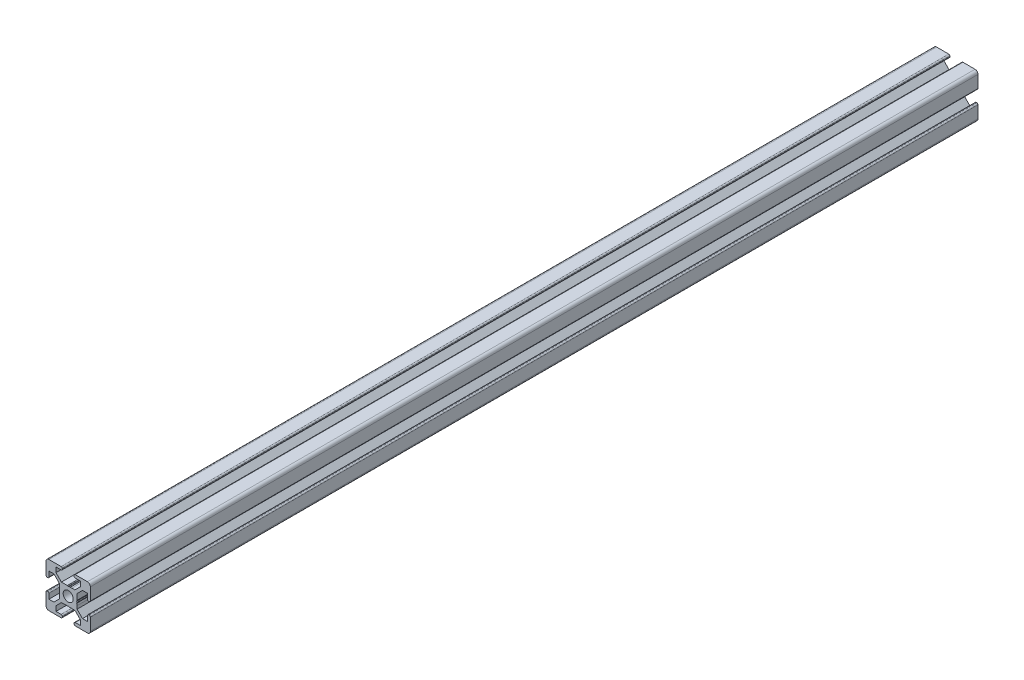
from build123d import *

# Parameters (mm, degrees)
SKETCH_11_R            = 3.4
F_30_X_30_X_R2_1_DEPTH = 600


with BuildPart() as part:
    # 草图11 → 铝型材 30 X 30 X R2(1) (new body)
    with BuildSketch(Plane.YX):
        with BuildLine():
            Line((-15, -4.8), (-15, -13))
            ThreePointArc((-15, -13), (-14.414213562, -14.414213562), (-13, -15))
            Line((-13, -15), (-4.8, -15))
            ThreePointArc((-4.8, -15), (-4.234314575, -14.765685425), (-4, -14.2))
            Line((-4, -14.2), (-4, -13.8))
            ThreePointArc((-4, -13.8), (-4.234314575, -13.234314575), (-4.8, -13))
            Line((-4.8, -13), (-8.25, -13))
            Line((-8.25, -13), (-8.25, -9.664213562))
            Line((-8.25, -9.664213562), (-4.585786438, -6))
            Line((-4.585786438, -6), (-0.653589838, -6))
            ThreePointArc((-0.653589838, -6), (-0.524180316, -5.982962913), (-0.403589838, -5.933012702))
            Line((-0.403589838, -5.933012702), (0, -5.7))
            Line((0, -5.7), (0.403589838, -5.933012702))
            ThreePointArc((0.403589838, -5.933012702), (0.653589838, -6), (0.903589838, -5.933012702))
            Line((0.903589838, -5.933012702), (1.218885629, -5.750976592))
            Line((1.218885629, -5.750976592), (2.5, -6))
            Line((2.5, -6), (4.585786438, -6))
            Line((4.585786438, -6), (8.25, -9.664213562))
            Line((8.25, -9.664213562), (8.25, -13))
            Line((8.25, -13), (4.8, -13))
            ThreePointArc((4.8, -13), (4.234314575, -13.234314575), (4, -13.8))
            Line((4, -13.8), (4, -14.2))
            ThreePointArc((4, -14.2), (4.234314575, -14.765685425), (4.8, -15))
            Line((4.8, -15), (13, -15))
            ThreePointArc((13, -15), (14.414213562, -14.414213562), (15, -13))
            Line((15, -13), (15, -4.8))
            ThreePointArc((15, -4.8), (14.765685425, -4.234314575), (14.2, -4))
            Line((14.2, -4), (13.8, -4))
            ThreePointArc((13.8, -4), (13.234314575, -4.234314575), (13, -4.8))
            Line((13, -4.8), (13, -8.25))
            Line((13, -8.25), (9.664213562, -8.25))
            Line((9.664213562, -8.25), (6, -4.585786438))
            Line((6, -4.585786438), (6, -0.653589838))
            ThreePointArc((6, -0.653589838), (5.982962913, -0.524180316), (5.933012702, -0.403589838))
            Line((5.933012702, -0.403589838), (5.7, 0))
            Line((5.7, 0), (5.933012702, 0.403589838))
            ThreePointArc((5.933012702, 0.403589838), (6, 0.653589838), (5.933012702, 0.903589838))
            Line((5.933012702, 0.903589838), (5.750976592, 1.218885629))
            Line((5.750976592, 1.218885629), (6, 2.5))
            Line((6, 2.5), (6, 4.585786438))
            Line((6, 4.585786438), (9.664213562, 8.25))
            Line((9.664213562, 8.25), (13, 8.25))
            Line((13, 8.25), (13, 4.8))
            ThreePointArc((13, 4.8), (13.234314575, 4.234314575), (13.8, 4))
            Line((13.8, 4), (14.2, 4))
            ThreePointArc((14.2, 4), (14.765685425, 4.234314575), (15, 4.8))
            Line((15, 4.8), (15, 13))
            ThreePointArc((15, 13), (14.414213562, 14.414213562), (13, 15))
            Line((13, 15), (4.8, 15))
            ThreePointArc((4.8, 15), (4.234314575, 14.765685425), (4, 14.2))
            Line((4, 14.2), (4, 13.8))
            ThreePointArc((4, 13.8), (4.234314575, 13.234314575), (4.8, 13))
            Line((4.8, 13), (8.25, 13))
            Line((8.25, 13), (8.25, 9.664213562))
            Line((8.25, 9.664213562), (4.585786438, 6))
            Line((4.585786438, 6), (0.653589838, 6))
            ThreePointArc((0.653589838, 6), (0.524180316, 5.982962913), (0.403589838, 5.933012702))
            Line((0.403589838, 5.933012702), (0, 5.7))
            Line((0, 5.7), (-0.403589838, 5.933012702))
            ThreePointArc((-0.403589838, 5.933012702), (-0.653589838, 6), (-0.903589838, 5.933012702))
            Line((-0.903589838, 5.933012702), (-1.218885629, 5.750976592))
            Line((-1.218885629, 5.750976592), (-2.5, 6))
            Line((-2.5, 6), (-4.585786438, 6))
            Line((-4.585786438, 6), (-8.25, 9.664213562))
            Line((-8.25, 9.664213562), (-8.25, 13))
            Line((-8.25, 13), (-4.8, 13))
            ThreePointArc((-4.8, 13), (-4.234314575, 13.234314575), (-4, 13.8))
            Line((-4, 13.8), (-4, 14.2))
            ThreePointArc((-4, 14.2), (-4.234314575, 14.765685425), (-4.8, 15))
            Line((-4.8, 15), (-13, 15))
            ThreePointArc((-13, 15), (-14.414213562, 14.414213562), (-15, 13))
            Line((-15, 13), (-15, 4.8))
            ThreePointArc((-15, 4.8), (-14.765685425, 4.234314575), (-14.2, 4))
            Line((-14.2, 4), (-13.8, 4))
            ThreePointArc((-13.8, 4), (-13.234314575, 4.234314575), (-13, 4.8))
            Line((-13, 4.8), (-13, 8.25))
            Line((-13, 8.25), (-9.664213562, 8.25))
            Line((-9.664213562, 8.25), (-6, 4.585786438))
            Line((-6, 4.585786438), (-6, 0.653589838))
            ThreePointArc((-6, 0.653589838), (-5.982962913, 0.524180316), (-5.933012702, 0.403589838))
            Line((-5.933012702, 0.403589838), (-5.7, 0))
            Line((-5.7, 0), (-5.933012702, -0.403589838))
            ThreePointArc((-5.933012702, -0.403589838), (-6, -0.653589838), (-5.933012702, -0.903589838))
            Line((-5.933012702, -0.903589838), (-5.750976592, -1.218885629))
            Line((-5.750976592, -1.218885629), (-6, -2.5))
            Line((-6, -2.5), (-6, -4.585786438))
            Line((-6, -4.585786438), (-9.664213562, -8.25))
            Line((-9.664213562, -8.25), (-13, -8.25))
            Line((-13, -8.25), (-13, -4.8))
            ThreePointArc((-13, -4.8), (-13.234314575, -4.234314575), (-13.8, -4))
            Line((-13.8, -4), (-14.2, -4))
            ThreePointArc((-14.2, -4), (-14.765685425, -4.234314575), (-15, -4.8))
        make_face()
        Circle(SKETCH_11_R, mode=Mode.SUBTRACT)
    extrude(amount=F_30_X_30_X_R2_1_DEPTH)


solid = part.part
